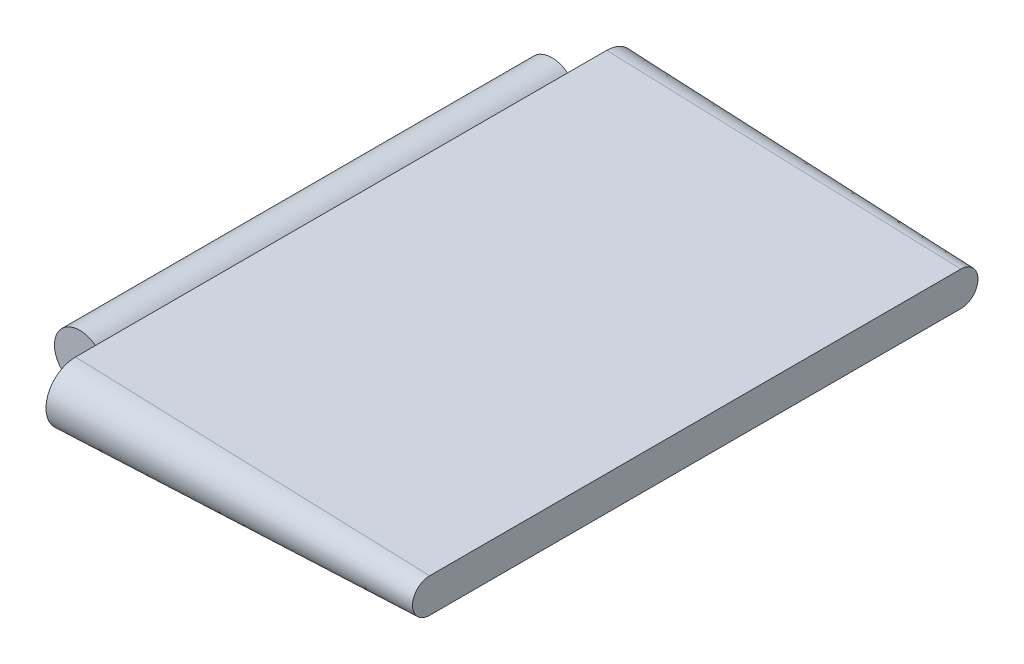
from build123d import *

# Parameters (mm, degrees)
BOSS_EXTRUDE1_DEPTH      = 150
BOSS_EXTRUDE1_TAPER      = 2
BOSS_EXTRUDE3_DEPTH      = 100
BOSS_EXTRUDE3_DEPTH_BACK = 100
SKETCH3_R                = 10.713278849


with BuildPart() as part:
    # Sketch1 → Boss-Extrude1 (new body)
    with BuildSketch(Plane(origin=(0, 0, 0), x_dir=(0, 0, -1), z_dir=(1, 0, 0))):
        with BuildLine():
            ThreePointArc((-112.5, 12.5), (-125, 0), (-112.5, -12.5))
            Line((-112.5, -12.5), (112.5, -12.5))
            ThreePointArc((112.5, -12.5), (125, 0), (112.5, 12.5))
            Line((112.5, 12.5), (-112.5, 12.5))
        make_face()
    extrude(amount=BOSS_EXTRUDE1_DEPTH, taper=BOSS_EXTRUDE1_TAPER)


with BuildPart() as body_2:
    # Sketch3 → Boss-Extrude3 (new, two sides: drawn at the far end of the back side and taken through both)
    with BuildSketch(Plane.XY.offset(-BOSS_EXTRUDE3_DEPTH_BACK)):
        with Locations((-10.713278849, 0)):
            Circle(SKETCH3_R)
    extrude(amount=BOSS_EXTRUDE3_DEPTH + BOSS_EXTRUDE3_DEPTH_BACK)


solid = Compound([part.part, body_2.part])
